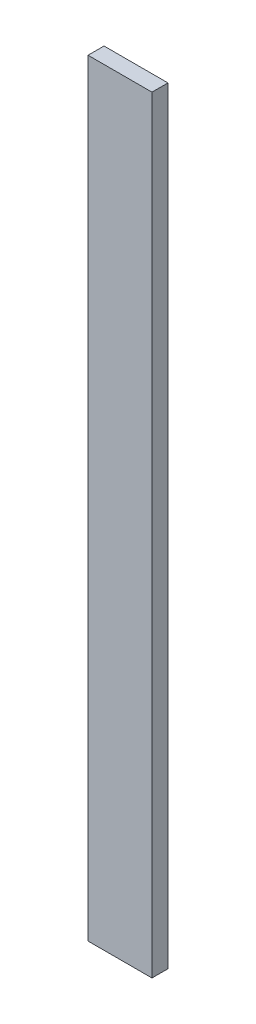
from build123d import *

# Parameters (mm, degrees)
ESQUISSE1_W        = 25.4
ESQUISSE1_H        = 304.8
BOSS_EXTRU_1_DEPTH = 6.35


with BuildPart() as part:
    # Esquisse1 → Boss.-Extru.1 (new body)
    with BuildSketch(Plane.XY):
        Rectangle(ESQUISSE1_W, ESQUISSE1_H)
    extrude(amount=BOSS_EXTRU_1_DEPTH)


solid = part.part
